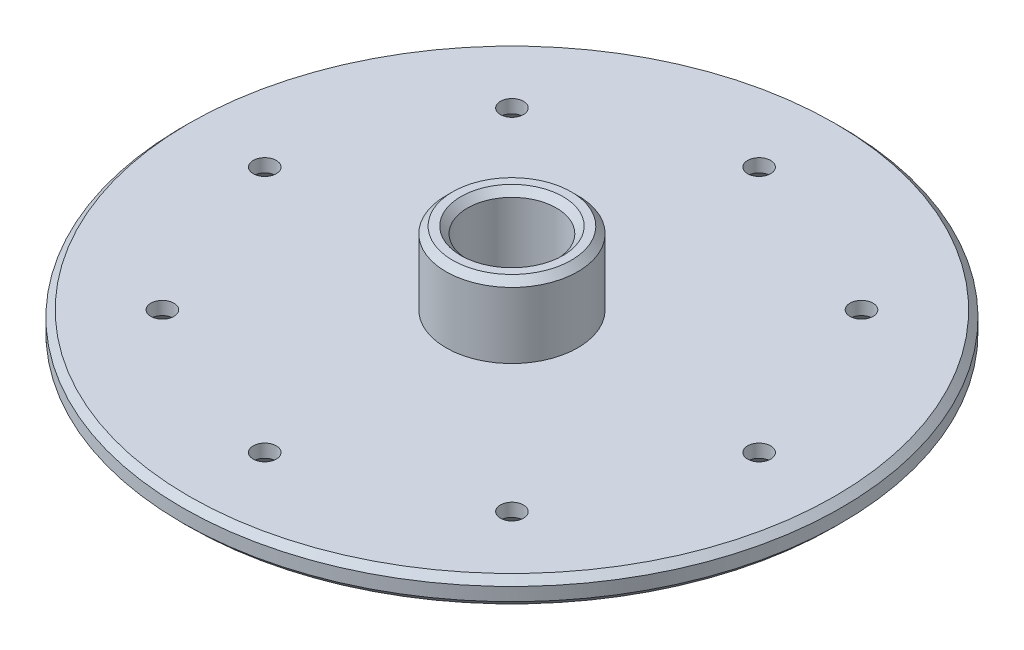
from build123d import *

# Parameters (mm, degrees)
CUT_EXTRUDE1_DEPTH      = 74.218850032
CUT_EXTRUDE1_DEPTH_BACK = 74.218850032
SKETCH2_R               = 1.75
CHAMFER1_SIZE           = 2


with BuildPart() as part:
    # Sketch1 → Revolve1 (revolve)
    with BuildSketch(Plane(origin=(0, 0, 0), x_dir=(0, 0, -1), z_dir=(1, 0, 0))):
        Polygon((-10, 14), (-10, 4), (-49, 4), (-50, 3), (-50, 1), (-49, 0), (-19, 0), (-18, -1), (-18, -14), (-17, -15), (-15.25, -15), (-14.25, -14), (-14.25, -5.1), (-14.15, -5), (-11.75, -5), (-6.75, 0), (-6.75, 14), (-7.75, 15), (-9, 15), align=None)
    revolve(axis=Axis((0, 143.307692308, 0), (0, -1, 0)))

    # Sketch2 → Cut-Extrude1 (cut, two sides: drawn at the far end of the back side and taken through both)
    with BuildSketch(Plane(origin=(0, 4, 0), x_dir=(1, 0, 0), z_dir=(0, 1, 0)).offset(-CUT_EXTRUDE1_DEPTH_BACK)):
        with Locations(Location((0, 37.5, 0), (0, 0, 270))):
            Circle(SKETCH2_R)
        with Locations(Location((26.516504294, 26.516504294, 0), (0, 0, 270))):
            Circle(SKETCH2_R)
        with Locations(Location((37.5, 0, 0), (0, 0, 270))):
            Circle(SKETCH2_R)
        with Locations(Location((26.516504294, -26.516504294, 0), (0, 0, 270))):
            Circle(SKETCH2_R)
        with Locations(Location((0, -37.5, 0), (0, 0, 270))):
            Circle(SKETCH2_R)
        with Locations(Location((-26.516504294, -26.516504294, 0), (0, 0, 270))):
            Circle(SKETCH2_R)
        with Locations(Location((-37.5, 0, 0), (0, 0, 270))):
            Circle(SKETCH2_R)
        with Locations(Location((-26.516504294, 26.516504294, 0), (0, 0, 270))):
            Circle(SKETCH2_R)
    extrude(amount=CUT_EXTRUDE1_DEPTH + CUT_EXTRUDE1_DEPTH_BACK, mode=Mode.SUBTRACT)

    # Chamfer1
    chamfer1_edges = [part.edges().sort_by_distance(p)[0] for p in [
        (0, 0, -39.25),
        (26.516504294, 0, -28.266504294),
        (37.5, 0, -1.75),
        (26.516504294, 0, 24.766504294),
        (0, 0, 35.75),
        (-26.516504294, 0, 24.766504294),
        (-37.5, 0, -1.75),
        (-26.516504294, 0, -28.266504294),
    ]]
    chamfer(chamfer1_edges, length=CHAMFER1_SIZE)


solid = part.part
